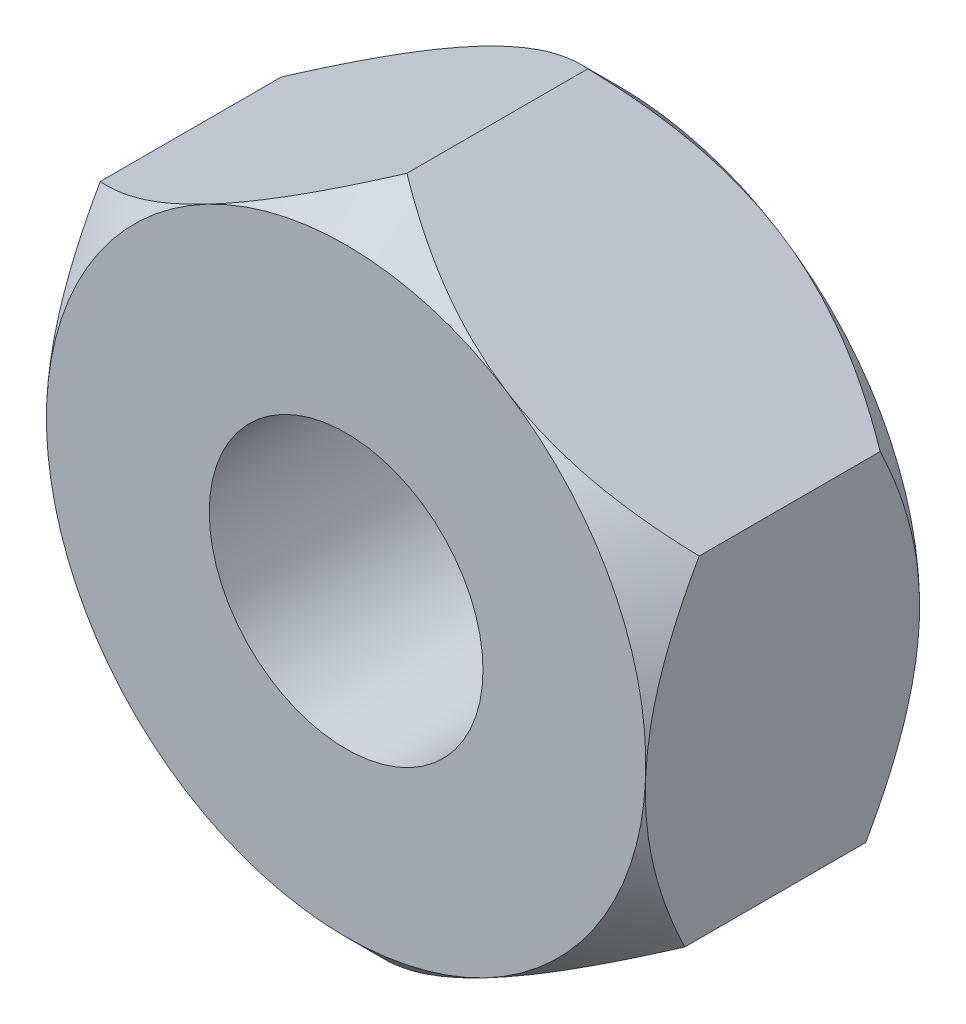
from build123d import *

# Parameters (mm, degrees)
SKETCH1_R               = 4.75
BOSS_EXTRUDE1_DEPTH     = 4.75
SKETCH2_OUTSIDE_W       = 48.976
SKETCH2_OUTSIDE_H       = 51.692
SKETCH2_OUTSIDE_R       = 10.401298529
CUT_EXTRUDE1_DEPTH      = 9.5
CUT_EXTRUDE1_DRAFT      = -45
MIRROR1_COPY_1_SKETCH_W = 48.976
MIRROR1_COPY_1_SKETCH_H = 51.692
MIRROR1_COPY_1_SKETCH_R = 10.401298529
MIRROR1_COPY_1_DEPTH    = 9.5
MIRROR1_COPY_1_DRAFT    = -45


with BuildPart() as part:
    # Sketch1 → Boss-Extrude1 (new, symmetric)
    with BuildSketch(Plane.XY):
        Polygon((10.142630994, -6.432447795), (10.641978696, 5.567552205), (0.499347702, 12), (-10.142630994, 6.432447795), (-10.641978696, -5.567552205), (-0.499347702, -12), align=None)
        Circle(SKETCH1_R, mode=Mode.SUBTRACT)
    extrude(amount=BOSS_EXTRUDE1_DEPTH, both=True)


with BuildPart() as cut_extrude1_tool:
    # Sketch2 outside → Cut-Extrude1 (with draft: the straight prism first)
    with BuildSketch(Plane.XY.offset(4.75)):
        Rectangle(SKETCH2_OUTSIDE_W, SKETCH2_OUTSIDE_H)
        Circle(SKETCH2_OUTSIDE_R, mode=Mode.SUBTRACT)
    extrude(amount=-CUT_EXTRUDE1_DEPTH)
    # Cut-Extrude1: the draft: its side faces are tilted about the plane it starts from
    cut_extrude1_sides = [cut_extrude1_tool.faces().sort_by_distance(p)[0] for p in [
        (0, -25.846, 0),
        (24.488, 0, 0),
        (0, 25.846, 0),
        (-24.488, 0, 0),
        (-10.401298529, 0, 0),
    ]]
    draft(cut_extrude1_sides, Plane.XY.offset(4.75), CUT_EXTRUDE1_DRAFT)


with BuildPart() as part_1:
    add(part.part)

    # Cut-Extrude1: cut by cut_extrude1_tool
    add(cut_extrude1_tool.part, mode=Mode.SUBTRACT)


with BuildPart() as mirror1_copy_1_tool:
    # Mirror1 copy 1 sketch → Mirror1 copy 1 (with draft: the straight prism first)
    with BuildSketch(Plane(origin=(0, 0, -4.75), x_dir=(1, 0, 0), z_dir=(0, 0, -1))):
        Rectangle(MIRROR1_COPY_1_SKETCH_W, MIRROR1_COPY_1_SKETCH_H)
        Circle(MIRROR1_COPY_1_SKETCH_R, mode=Mode.SUBTRACT)
    extrude(amount=-MIRROR1_COPY_1_DEPTH)
    # Mirror1 copy 1: the draft: its side faces are tilted about the plane it starts from
    mirror1_copy_1_sides = [mirror1_copy_1_tool.faces().sort_by_distance(p)[0] for p in [
        (0, -25.846, 0),
        (24.488, 0, 0),
        (0, 25.846, 0),
        (-24.488, 0, 0),
        (-10.401298529, 0, 0),
    ]]
    draft(mirror1_copy_1_sides, Plane(origin=(0, 0, -4.75), x_dir=(1, 0, 0), z_dir=(0, 0, -1)), MIRROR1_COPY_1_DRAFT)


with BuildPart() as part_2:
    add(part_1.part)

    # Mirror1 copy 1: cut by mirror1_copy_1_tool
    add(mirror1_copy_1_tool.part, mode=Mode.SUBTRACT)


solid = part_2.part
